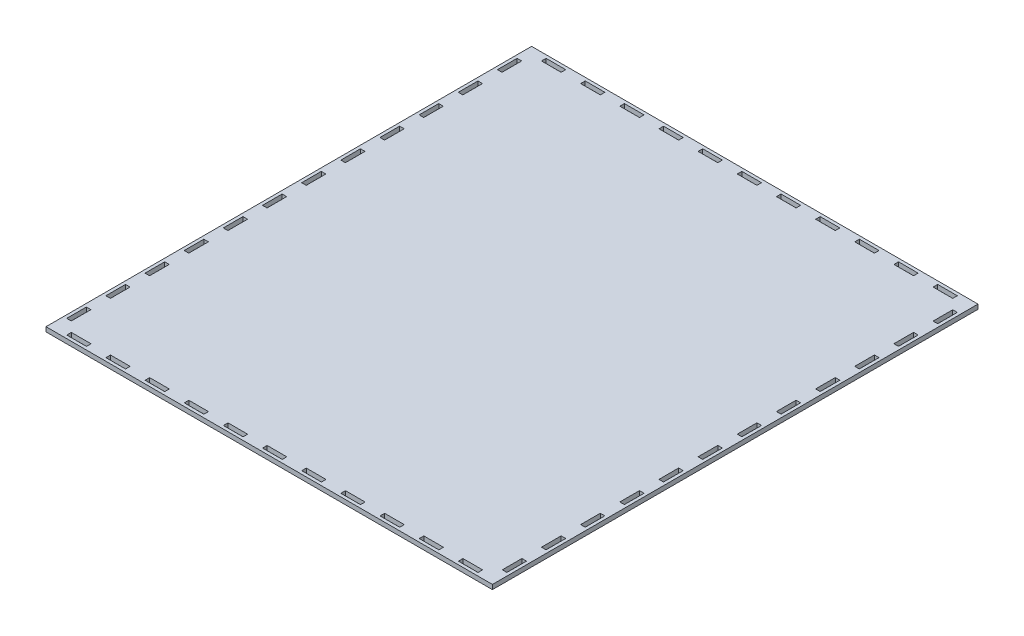
from build123d import *

# Parameters (mm, degrees)
SKETCH1_W           = 570
SKETCH1_H           = 620
SKETCH1_W_2         = 25.1
SKETCH1_H_2         = 5.85
SKETCH1_W_3         = 5.85
SKETCH1_H_3         = 25.1
BOSS_EXTRUDE1_DEPTH = 5.8


with BuildPart() as part:
    # Sketch1 → Boss-Extrude1 (new body)
    with BuildSketch(Plane(origin=(0, 0, 0), x_dir=(1, 0, 0), z_dir=(0, 1, 0))):
        Rectangle(SKETCH1_W, SKETCH1_H)
        with Locations((-199.95, 303.075)):
            Rectangle(SKETCH1_W_2, SKETCH1_H_2, mode=Mode.SUBTRACT)
        with Locations((-249.95, 303.075)):
            Rectangle(SKETCH1_W_2, SKETCH1_H_2, mode=Mode.SUBTRACT)
        with Locations((-149.95, 303.075)):
            Rectangle(SKETCH1_W_2, SKETCH1_H_2, mode=Mode.SUBTRACT)
        with Locations((-99.95, 303.075)):
            Rectangle(SKETCH1_W_2, SKETCH1_H_2, mode=Mode.SUBTRACT)
        with Locations((-49.95, 303.075)):
            Rectangle(SKETCH1_W_2, SKETCH1_H_2, mode=Mode.SUBTRACT)
        with Locations((0.05, 303.075)):
            Rectangle(SKETCH1_W_2, SKETCH1_H_2, mode=Mode.SUBTRACT)
        with Locations((50.05, 303.075)):
            Rectangle(SKETCH1_W_2, SKETCH1_H_2, mode=Mode.SUBTRACT)
        with Locations((100.05, 303.075)):
            Rectangle(SKETCH1_W_2, SKETCH1_H_2, mode=Mode.SUBTRACT)
        with Locations((150.05, 303.075)):
            Rectangle(SKETCH1_W_2, SKETCH1_H_2, mode=Mode.SUBTRACT)
        with Locations((200.05, 303.075)):
            Rectangle(SKETCH1_W_2, SKETCH1_H_2, mode=Mode.SUBTRACT)
        with Locations((250.05, 303.075)):
            Rectangle(SKETCH1_W_2, SKETCH1_H_2, mode=Mode.SUBTRACT)
        with Locations((250.05, -303.075)):
            Rectangle(SKETCH1_W_2, SKETCH1_H_2, mode=Mode.SUBTRACT)
        with Locations((200.05, -303.075)):
            Rectangle(SKETCH1_W_2, SKETCH1_H_2, mode=Mode.SUBTRACT)
        with Locations((150.05, -303.075)):
            Rectangle(SKETCH1_W_2, SKETCH1_H_2, mode=Mode.SUBTRACT)
        with Locations((100.05, -303.075)):
            Rectangle(SKETCH1_W_2, SKETCH1_H_2, mode=Mode.SUBTRACT)
        with Locations((50.05, -303.075)):
            Rectangle(SKETCH1_W_2, SKETCH1_H_2, mode=Mode.SUBTRACT)
        with Locations((0.05, -303.075)):
            Rectangle(SKETCH1_W_2, SKETCH1_H_2, mode=Mode.SUBTRACT)
        with Locations((-49.95, -303.075)):
            Rectangle(SKETCH1_W_2, SKETCH1_H_2, mode=Mode.SUBTRACT)
        with Locations((-99.95, -303.075)):
            Rectangle(SKETCH1_W_2, SKETCH1_H_2, mode=Mode.SUBTRACT)
        with Locations((-149.95, -303.075)):
            Rectangle(SKETCH1_W_2, SKETCH1_H_2, mode=Mode.SUBTRACT)
        with Locations((-199.95, -303.075)):
            Rectangle(SKETCH1_W_2, SKETCH1_H_2, mode=Mode.SUBTRACT)
        with Locations((-249.95, -303.075)):
            Rectangle(SKETCH1_W_2, SKETCH1_H_2, mode=Mode.SUBTRACT)
        with Locations((-278.075, 224.95)):
            Rectangle(SKETCH1_W_3, SKETCH1_H_3, mode=Mode.SUBTRACT)
        with Locations((-278.075, 274.95)):
            Rectangle(SKETCH1_W_3, SKETCH1_H_3, mode=Mode.SUBTRACT)
        with Locations((-278.075, 174.95)):
            Rectangle(SKETCH1_W_3, SKETCH1_H_3, mode=Mode.SUBTRACT)
        with Locations((-278.075, 124.95)):
            Rectangle(SKETCH1_W_3, SKETCH1_H_3, mode=Mode.SUBTRACT)
        with Locations((-278.075, 74.95)):
            Rectangle(SKETCH1_W_3, SKETCH1_H_3, mode=Mode.SUBTRACT)
        with Locations((-278.075, 24.95)):
            Rectangle(SKETCH1_W_3, SKETCH1_H_3, mode=Mode.SUBTRACT)
        with Locations((-278.075, -25.05)):
            Rectangle(SKETCH1_W_3, SKETCH1_H_3, mode=Mode.SUBTRACT)
        with Locations((-278.075, -75.05)):
            Rectangle(SKETCH1_W_3, SKETCH1_H_3, mode=Mode.SUBTRACT)
        with Locations((-278.075, -125.05)):
            Rectangle(SKETCH1_W_3, SKETCH1_H_3, mode=Mode.SUBTRACT)
        with Locations((-278.075, -175.05)):
            Rectangle(SKETCH1_W_3, SKETCH1_H_3, mode=Mode.SUBTRACT)
        with Locations((-278.075, -225.05)):
            Rectangle(SKETCH1_W_3, SKETCH1_H_3, mode=Mode.SUBTRACT)
        with Locations((-278.075, -275.05)):
            Rectangle(SKETCH1_W_3, SKETCH1_H_3, mode=Mode.SUBTRACT)
        with Locations((278.075, -274.95)):
            Rectangle(SKETCH1_W_3, SKETCH1_H_3, mode=Mode.SUBTRACT)
        with Locations((278.075, -224.95)):
            Rectangle(SKETCH1_W_3, SKETCH1_H_3, mode=Mode.SUBTRACT)
        with Locations((278.075, -174.95)):
            Rectangle(SKETCH1_W_3, SKETCH1_H_3, mode=Mode.SUBTRACT)
        with Locations((278.075, -124.95)):
            Rectangle(SKETCH1_W_3, SKETCH1_H_3, mode=Mode.SUBTRACT)
        with Locations((278.075, -74.95)):
            Rectangle(SKETCH1_W_3, SKETCH1_H_3, mode=Mode.SUBTRACT)
        with Locations((278.075, -24.95)):
            Rectangle(SKETCH1_W_3, SKETCH1_H_3, mode=Mode.SUBTRACT)
        with Locations((278.075, 25.05)):
            Rectangle(SKETCH1_W_3, SKETCH1_H_3, mode=Mode.SUBTRACT)
        with Locations((278.075, 75.05)):
            Rectangle(SKETCH1_W_3, SKETCH1_H_3, mode=Mode.SUBTRACT)
        with Locations((278.075, 125.05)):
            Rectangle(SKETCH1_W_3, SKETCH1_H_3, mode=Mode.SUBTRACT)
        with Locations((278.075, 175.05)):
            Rectangle(SKETCH1_W_3, SKETCH1_H_3, mode=Mode.SUBTRACT)
        with Locations((278.075, 225.05)):
            Rectangle(SKETCH1_W_3, SKETCH1_H_3, mode=Mode.SUBTRACT)
        with Locations((278.075, 275.05)):
            Rectangle(SKETCH1_W_3, SKETCH1_H_3, mode=Mode.SUBTRACT)
    extrude(amount=BOSS_EXTRUDE1_DEPTH)


solid = part.part
